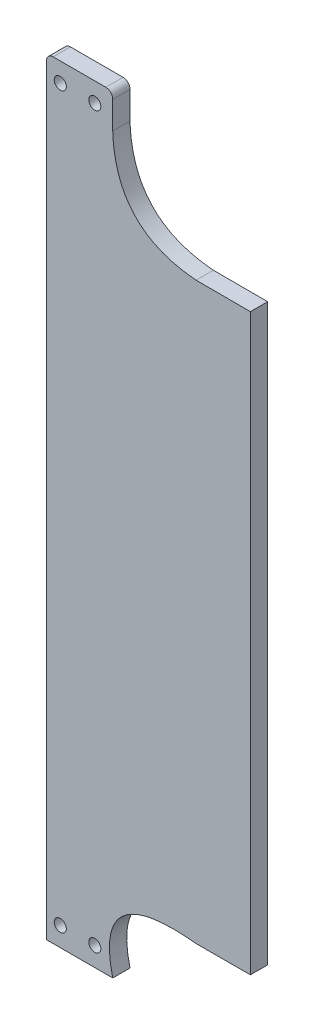
from build123d import *

# Parameters (mm, degrees)
SKETCH1_R           = 1.75
BOSS_EXTRUDE1_DEPTH = 5


with BuildPart() as part:
    # Sketch1 → Boss-Extrude1 (new body)
    with BuildSketch(Plane.XY):
        with BuildLine():
            Line((3.927550053, -314), (1.927551127, -314))
            Line((1.927551127, -314), (-13.309839226, -314))
            Line((-13.309839226, -314), (-15.309839226, -314))
            Line((-15.309839226, -314), (-15.309839226, -106.128211153))
            Line((-15.309839226, -106.128211153), (-15.309839226, -93.5))
            ThreePointArc((-15.309839226, -93.5), (-14.724052788, -92.085786438), (-13.309839226, -91.5))
            Line((-13.309839226, -91.5), (1.927551127, -91.5))
            ThreePointArc((1.927551127, -91.5), (3.342497106, -92.086519234), (3.927550053, -93.502072123))
            Line((3.927550053, -93.502072123), (3.919263706, -101.5))
            add(Edge.make_bspline(
                [(3.919263706, -101.5), (4.762029824, -124.978966699), (28.065591749, -126.82575045)],
                knots=[0, 0, 0, 1, 1, 1], degree=2))
            Line((28.065591749, -126.82575045), (43.809757496, -126.863648017))
            Line((43.809757496, -126.863648017), (43.809757496, -293.264563137))
            Line((43.809757496, -293.264563137), (28.065591749, -293.302460704))
            add(Edge.make_bspline(
                [(3.927550053, -314), (-1.943550438, -290.062596381), (28.065591749, -293.302460704)],
                knots=[0, 0, 0, 1, 1, 1], degree=2))
        make_face()
        with Locations((-11.275154001, -97.093813656)):
            Circle(SKETCH1_R, mode=Mode.SUBTRACT)
        with Locations((-1.275154001, -97.093813656)):
            Circle(SKETCH1_R, mode=Mode.SUBTRACT)
        with Locations(Location((-1.275154001, -308.406186344, 0), (0, 0, 180))):
            Circle(SKETCH1_R, mode=Mode.SUBTRACT)
        with Locations(Location((-11.275154001, -308.406186344, 0), (0, 0, 180))):
            Circle(SKETCH1_R, mode=Mode.SUBTRACT)
    extrude(amount=BOSS_EXTRUDE1_DEPTH)


solid = part.part
